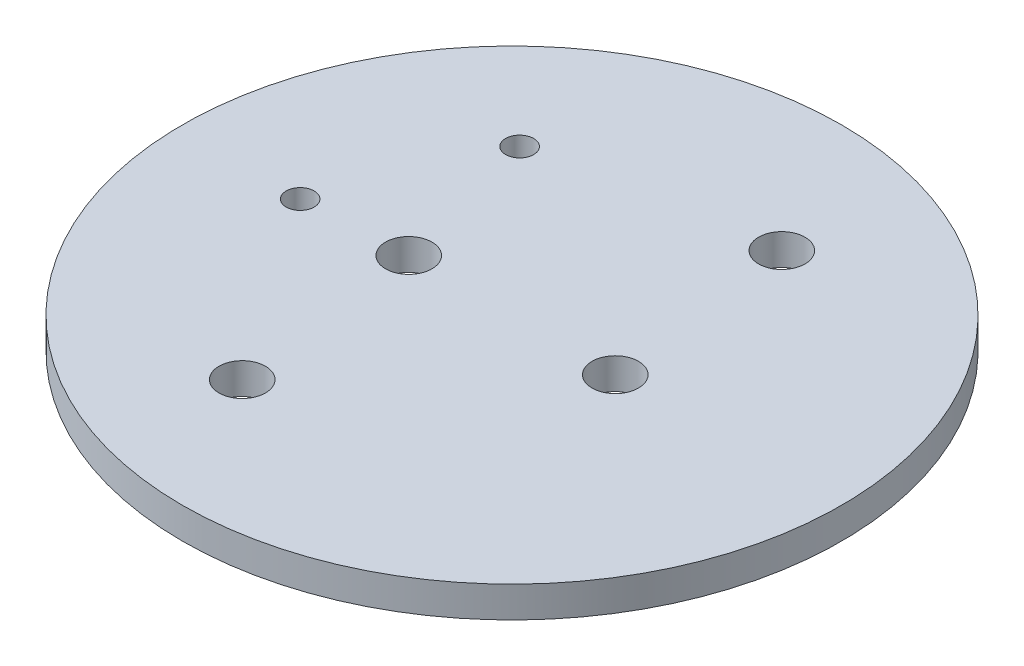
from build123d import *

# Parameters (mm, degrees)
SKETCH1_R                 = 50.673
SKETCH1_R_2               = 3.5687
BOSS_EXTRUDE1_DEPTH       = 4.7752
F_6_CLEARANCE_HOLE1_D     = 4.3053
F_6_CLEARANCE_HOLE1_DEPTH = 10.668
F_6_CLEARANCE_HOLE1_TIP   = 1.293442612


with BuildPart() as part:
    # Sketch1 → Boss-Extrude1 (new body)
    with BuildSketch(Plane(origin=(0, 0, 0), x_dir=(1, 0, 0), z_dir=(0, 1, 0))):
        with Locations(Location((0, 0, 0), (0, 0, 270))):
            Circle(SKETCH1_R)
        with Locations(Location((12.150198978, 29.333175157, 0), (0, 0, 270))):
            Circle(SKETCH1_R_2, mode=Mode.SUBTRACT)
        with Locations(Location((-12.150198978, -29.333175157, 0), (0, 0, 270))):
            Circle(SKETCH1_R_2, mode=Mode.SUBTRACT)
        with Locations(Location((-15.875, 0, 0), (0, 0, 270))):
            Circle(SKETCH1_R_2, mode=Mode.SUBTRACT)
        with Locations(Location((15.875, 0, 0), (0, 0, 270))):
            Circle(SKETCH1_R_2, mode=Mode.SUBTRACT)
    extrude(amount=BOSS_EXTRUDE1_DEPTH)

    # #6 Clearance Hole1
    with Locations(Plane(origin=(0, 4.7752, 0), x_dir=(1, 0, 0), z_dir=(0, 1, 0))):
        with Locations((-21.855257778, 23.03063628), (-31.739120068, -0.831118109)):
            Hole(F_6_CLEARANCE_HOLE1_D / 2, depth=F_6_CLEARANCE_HOLE1_DEPTH)
            with Locations((0, 0, -(F_6_CLEARANCE_HOLE1_DEPTH + F_6_CLEARANCE_HOLE1_TIP / 2))):  # 118° drill point
                Cone(0, F_6_CLEARANCE_HOLE1_D / 2, F_6_CLEARANCE_HOLE1_TIP, mode=Mode.SUBTRACT)


solid = part.part
